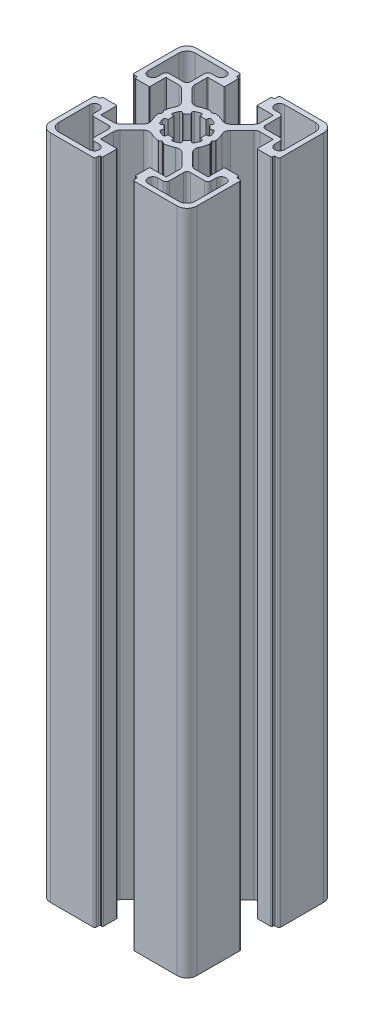
from build123d import *

# Parameters (mm, degrees)
BOSS_EXTRUDE1_DEPTH = 205


with BuildPart() as part:
    # Sketch1 → Boss-Extrude1 (new body)
    with BuildSketch(Plane(origin=(0, 0, 0), x_dir=(1, 0, 0), z_dir=(0, 1, 0))):
        with BuildLine():
            Line((7.563483841, 5.858695924), (11.129779796, 9.424987881))
            ThreePointArc((11.129779796, 9.424987881), (11.76062452, 9.846504465), (12.504756421, 9.994521395))
            Line((12.504756421, 9.994521395), (16.316902359, 9.994521395))
            ThreePointArc((16.316902359, 9.994521395), (16.458323963, 9.935942648), (16.51690271, 9.794521044))
            Line((16.51690271, 9.794521044), (16.51690271, 5.20001408))
            ThreePointArc((16.51690271, 5.20001408), (16.575481456, 5.058592476), (16.716903061, 5.000013729))
            Line((16.716903061, 5.000013729), (20.719599813, 5.000013729))
            ThreePointArc((20.719599813, 5.000013729), (20.931731335, 5.087881483), (21.019599089, 5.300013005))
            Line((21.019599089, 5.300013005), (21.019599089, 5.500003954))
            ThreePointArc((21.019599089, 5.500003954), (21.107466988, 5.71213583), (21.319598864, 5.800003729))
            Line((21.319598864, 5.800003729), (21.999979422, 5.800003729))
            ThreePointArc((21.999979422, 5.800003729), (22.353532548, 5.946450229), (22.499979048, 6.300003356))
            Line((22.499979048, 6.300003356), (22.499979048, 19.500015971))
            ThreePointArc((22.499979048, 19.500015971), (21.621300048, 21.62133473), (19.499981289, 22.50001373))
            Line((19.499981289, 22.50001373), (6.37570892, 22.50001373))
            ThreePointArc((6.37570892, 22.50001373), (6.022155794, 22.35356723), (5.875709294, 22.000014103))
            Line((5.875709294, 22.000014103), (5.875709294, 21.300013005))
            ThreePointArc((5.875709294, 21.300013005), (5.78784154, 21.087881482), (5.575710018, 21.000013729))
            Line((5.575710018, 21.000013729), (5.299998684, 21.000013729))
            ThreePointArc((5.299998684, 21.000013729), (5.087867516, 20.912146122), (4.999999909, 20.700014953))
            Line((4.999999909, 20.700014953), (4.999999909, 16.666812288))
            ThreePointArc((4.999999909, 16.666812288), (5.058578802, 16.52539033), (5.20000076, 16.466811437))
            Line((5.20000076, 16.466811437), (9.905385127, 16.466811437))
            ThreePointArc((9.905385127, 16.466811437), (10.046806731, 16.408232691), (10.105385478, 16.266811086))
            Line((10.105385478, 16.266811086), (10.105385478, 12.471582811))
            ThreePointArc((10.105385478, 12.471582811), (9.953144497, 11.706215717), (9.519598864, 11.057368824))
            Line((9.519598864, 11.057368824), (5.944897897, 7.482667857))
            ThreePointArc((5.944897897, 7.482667857), (4.854602604, 6.96783564), (3.666501718, 7.17329201))
            ThreePointArc((3.666501718, 7.17329201), (2.308631207, 7.714000899), (0.875344921, 8.000128222))
            ThreePointArc((0.875344921, 8.000128222), (0.813048151, 7.996979672), (0.754751151, 7.974792726))
            Line((0.754751151, 7.974792726), (0.112630526, 7.606936313))
            ThreePointArc((0.112630526, 7.606936313), (0.062965968, 7.559088119), (2.065e-06, 7.530953356))
            ThreePointArc((2.065e-06, 7.530953356), (-0.062961837, 7.559088119), (-0.112626394, 7.606936313))
            Line((-0.112626394, 7.606936313), (-0.754745572, 7.974791896))
            ThreePointArc((-0.754745572, 7.974791896), (-0.813042564, 7.99697884), (-0.875339325, 8.000127394))
            ThreePointArc((-0.875339325, 8.000127394), (-2.308625867, 7.714000103), (-3.666496612, 7.173291142))
            ThreePointArc((-3.666496612, 7.173291142), (-4.854599203, 6.967834938), (-5.944895348, 7.482669215))
            Line((-5.944895348, 7.482669215), (-9.519596331, 11.057370197))
            ThreePointArc((-9.519596331, 11.057370197), (-9.953141964, 11.70621709), (-10.105382945, 12.471584185))
            Line((-10.105382945, 12.471584185), (-10.105382945, 16.266811086))
            ThreePointArc((-10.105382945, 16.266811086), (-10.046804198, 16.408232691), (-9.905382594, 16.466811437))
            Line((-9.905382594, 16.466811437), (-5.200000942, 16.466811437))
            ThreePointArc((-5.200000942, 16.466811437), (-5.058578984, 16.52539033), (-5.000000091, 16.666812288))
            Line((-5.000000091, 16.666812288), (-5.000000091, 20.700014953))
            ThreePointArc((-5.000000091, 20.700014953), (-5.087867699, 20.912146122), (-5.299998867, 21.000013729))
            Line((-5.299998867, 21.000013729), (-5.575710202, 21.000013729))
            ThreePointArc((-5.575710202, 21.000013729), (-5.787841724, 21.087881482), (-5.875709478, 21.300013005))
            Line((-5.875709478, 21.300013005), (-5.875709478, 22.000014104))
            ThreePointArc((-5.875709478, 22.000014104), (-6.022155978, 22.35356723), (-6.375709104, 22.50001373))
            Line((-6.375709104, 22.50001373), (-19.499981473, 22.50001373))
            ThreePointArc((-19.499981473, 22.50001373), (-21.621300232, 21.62133473), (-22.499979232, 19.500015971))
            Line((-22.499979232, 19.500015971), (-22.499979232, 6.300003356))
            ThreePointArc((-22.499979232, 6.300003356), (-22.353532732, 5.946450229), (-21.999979605, 5.800003729))
            Line((-21.999979605, 5.800003729), (-21.319599047, 5.800003729))
            ThreePointArc((-21.319599047, 5.800003729), (-21.107467171, 5.71213583), (-21.019599271, 5.500003954))
            Line((-21.019599271, 5.500003954), (-21.019599271, 5.300013005))
            ThreePointArc((-21.019599271, 5.300013005), (-20.931731518, 5.087881483), (-20.719599995, 5.000013729))
            Line((-20.719599995, 5.000013729), (-16.716903244, 5.000013729))
            ThreePointArc((-16.716903244, 5.000013729), (-16.57548164, 5.058592476), (-16.516902894, 5.20001408))
            Line((-16.516902894, 5.20001408), (-16.516902894, 9.794521044))
            ThreePointArc((-16.516902894, 9.794521044), (-16.458324147, 9.935942648), (-16.316902543, 9.994521395))
            Line((-16.316902543, 9.994521395), (-12.504755574, 9.994521395))
            ThreePointArc((-12.504755574, 9.994521395), (-11.760623673, 9.846504465), (-11.129778949, 9.424987881))
            Line((-11.129778949, 9.424987881), (-7.563484024, 5.858696956))
            ThreePointArc((-7.563484024, 5.858696956), (-7.018857309, 4.793955357), (-7.200363541, 3.611860429))
            ThreePointArc((-7.200363541, 3.611860429), (-7.719534914, 2.299057702), (-7.999860794, 0.915436613))
            ThreePointArc((-7.999860794, 0.915436613), (-7.996805132, 0.851929863), (-7.97397167, 0.792591196))
            Line((-7.97397167, 0.792591196), (-7.540055962, 0.046829926))
            ThreePointArc((-7.540055962, 0.046829926), (-7.534291471, 0.023676009), (-7.531325428, 3.7e-07))
            ThreePointArc((-7.531325428, 3.7e-07), (-7.534291471, -0.023675268), (-7.540055962, -0.046829185))
            Line((-7.540055962, -0.046829185), (-7.97397167, -0.792590455))
            ThreePointArc((-7.97397167, -0.792590455), (-7.996805132, -0.851929122), (-7.999860794, -0.915435872))
            ThreePointArc((-7.999860794, -0.915435872), (-7.719534914, -2.299056961), (-7.200363541, -3.611859688))
            ThreePointArc((-7.200363541, -3.611859688), (-7.018857309, -4.793954616), (-7.563484024, -5.858696215))
            Line((-7.563484024, -5.858696215), (-11.12977998, -9.424988171))
            ThreePointArc((-11.12977998, -9.424988171), (-11.760624704, -9.846504756), (-12.504756605, -9.994521685))
            Line((-12.504756605, -9.994521685), (-16.316902543, -9.994521685))
            ThreePointArc((-16.316902543, -9.994521685), (-16.458324147, -9.935942938), (-16.516902894, -9.794521334))
            Line((-16.516902894, -9.794521334), (-16.516902894, -5.200014371))
            ThreePointArc((-16.516902894, -5.200014371), (-16.57548164, -5.058592767), (-16.716903244, -5.000014021))
            Line((-16.716903244, -5.000014021), (-20.719599995, -5.000014021))
            ThreePointArc((-20.719599995, -5.000014021), (-20.931731518, -5.087881774), (-21.019599271, -5.300013296))
            Line((-21.019599271, -5.300013296), (-21.019599271, -5.500004245))
            ThreePointArc((-21.019599271, -5.500004245), (-21.107467171, -5.71213612), (-21.319599047, -5.80000402))
            Line((-21.319599047, -5.80000402), (-21.999979605, -5.80000402))
            ThreePointArc((-21.999979605, -5.80000402), (-22.353532732, -5.94645052), (-22.499979232, -6.300003647))
            Line((-22.499979232, -6.300003647), (-22.499979232, -19.500016261))
            ThreePointArc((-22.499979232, -19.500016261), (-21.621300232, -21.62133502), (-19.499981473, -22.50001402))
            Line((-19.499981473, -22.50001402), (-6.375709104, -22.50001402))
            ThreePointArc((-6.375709104, -22.50001402), (-6.022155978, -22.35356752), (-5.875709478, -22.000014394))
            Line((-5.875709478, -22.000014394), (-5.875709478, -21.300013295))
            ThreePointArc((-5.875709478, -21.300013295), (-5.787841724, -21.087881773), (-5.575710202, -21.000014019))
            Line((-5.575710202, -21.000014019), (-5.299998867, -21.000014019))
            ThreePointArc((-5.299998867, -21.000014019), (-5.087867699, -20.912146412), (-5.000000091, -20.700015244))
            Line((-5.000000091, -20.700015244), (-5.000000091, -16.666812578))
            ThreePointArc((-5.000000091, -16.666812578), (-5.058578984, -16.52539062), (-5.200000942, -16.466811727))
            Line((-5.200000942, -16.466811727), (-9.905382594, -16.466811727))
            ThreePointArc((-9.905382594, -16.466811727), (-10.046804198, -16.40823298), (-10.105382945, -16.266811376))
            Line((-10.105382945, -16.266811376), (-10.105382945, -12.471581681))
            ThreePointArc((-10.105382945, -12.471581681), (-9.953141964, -11.706214586), (-9.519596331, -11.057367693))
            Line((-9.519596331, -11.057367693), (-5.944895364, -7.482666726))
            ThreePointArc((-5.944895364, -7.482666726), (-4.854601518, -6.967832762), (-3.66650075, -7.173286521))
            ThreePointArc((-3.66650075, -7.173286521), (-2.30862839, -7.713996836), (-0.875339942, -8.000124808))
            ThreePointArc((-0.875339942, -8.000124808), (-0.81304361, -7.99697628), (-0.754747019, -7.97478949))
            Line((-0.754747019, -7.97478949), (-0.112626395, -7.606933078))
            ThreePointArc((-0.112626395, -7.606933078), (-0.062961838, -7.559084884), (2.065e-06, -7.530950121))
            ThreePointArc((2.065e-06, -7.530950121), (0.062965968, -7.559084884), (0.112630526, -7.606933078))
            Line((0.112630526, -7.606933078), (0.754751151, -7.974789491))
            ThreePointArc((0.754751151, -7.974789491), (0.813048151, -7.996976437), (0.875344921, -8.000124987))
            ThreePointArc((0.875344921, -8.000124987), (2.308629801, -7.71399808), (3.666499103, -7.173290103))
            ThreePointArc((3.666499103, -7.173290103), (4.854601719, -6.967833865), (5.944897897, -7.482668146))
            Line((5.944897897, -7.482668146), (9.519598864, -11.057369113))
            ThreePointArc((9.519598864, -11.057369113), (9.953144497, -11.706216006), (10.105385478, -12.471583101))
            Line((10.105385478, -12.471583101), (10.105385478, -16.266811376))
            ThreePointArc((10.105385478, -16.266811376), (10.046806731, -16.40823298), (9.905385127, -16.466811727))
            Line((9.905385127, -16.466811727), (5.20000076, -16.466811727))
            ThreePointArc((5.20000076, -16.466811727), (5.058578802, -16.52539062), (4.999999909, -16.666812578))
            Line((4.999999909, -16.666812578), (4.999999909, -20.700015244))
            ThreePointArc((4.999999909, -20.700015244), (5.087867516, -20.912146412), (5.299998684, -21.000014019))
            Line((5.299998684, -21.000014019), (5.575710018, -21.000014019))
            ThreePointArc((5.575710018, -21.000014019), (5.78784154, -21.087881773), (5.875709294, -21.300013295))
            Line((5.875709294, -21.300013295), (5.875709294, -22.000014394))
            ThreePointArc((5.875709294, -22.000014394), (6.022155794, -22.35356752), (6.37570892, -22.50001402))
            Line((6.37570892, -22.50001402), (19.499981289, -22.50001402))
            ThreePointArc((19.499981289, -22.50001402), (21.621300048, -21.62133502), (22.499979048, -19.500016261))
            Line((22.499979048, -19.500016261), (22.499979048, -6.300003646))
            ThreePointArc((22.499979048, -6.300003646), (22.353532548, -5.94645052), (21.999979422, -5.80000402))
            Line((21.999979422, -5.80000402), (21.319598864, -5.80000402))
            ThreePointArc((21.319598864, -5.80000402), (21.107466988, -5.71213612), (21.019599089, -5.500004245))
            Line((21.019599089, -5.500004245), (21.019599089, -5.300013297))
            ThreePointArc((21.019599089, -5.300013297), (20.931731335, -5.087881774), (20.719599813, -5.000014021))
            Line((20.719599813, -5.000014021), (16.716903061, -5.000014021))
            ThreePointArc((16.716903061, -5.000014021), (16.575481456, -5.058592767), (16.51690271, -5.200014371))
            Line((16.51690271, -5.200014371), (16.51690271, -9.794521334))
            ThreePointArc((16.51690271, -9.794521334), (16.458323963, -9.935942938), (16.316902359, -9.994521685))
            Line((16.316902359, -9.994521685), (12.504756421, -9.994521685))
            ThreePointArc((12.504756421, -9.994521685), (11.76062452, -9.846504756), (11.129779797, -9.424988171))
            Line((11.129779797, -9.424988171), (7.56348384, -5.858696215))
            ThreePointArc((7.56348384, -5.858696215), (7.018857125, -4.793954616), (7.200363357, -3.611859689))
            ThreePointArc((7.200363357, -3.611859689), (7.71953473, -2.299056961), (7.99986061, -0.915435872))
            ThreePointArc((7.99986061, -0.915435872), (7.996804948, -0.851929122), (7.973971486, -0.792590456))
            Line((7.973971486, -0.792590456), (7.54005578, -0.046829188))
            ThreePointArc((7.54005578, -0.046829188), (7.53429135, -0.023675779), (7.531325245, -6.6e-07))
            ThreePointArc((7.531325245, -6.6e-07), (7.534291289, 0.023674979), (7.54005578, 0.046828898))
            Line((7.54005578, 0.046828898), (7.973971486, 0.792590166))
            ThreePointArc((7.973971486, 0.792590166), (7.996804949, 0.851928832), (7.99986061, 0.915435582))
            ThreePointArc((7.99986061, 0.915435582), (7.719534731, 2.299056671), (7.200363358, 3.611859399))
            ThreePointArc((7.200363358, 3.611859399), (7.018857126, 4.793954326), (7.563483841, 5.858695924))
        make_face()
        with BuildLine():
            Line((-17.99997923, 9.000204729), (-17.99997923, 10.550013476))
            ThreePointArc((-17.99997923, 10.550013476), (-17.70708623, 11.257119729), (-16.999979977, 11.550012729))
            Line((-16.999979977, 11.550012729), (-12.549977483, 11.550012729))
            ThreePointArc((-12.549977483, 11.550012729), (-11.84287123, 11.842905729), (-11.54997823, 12.550011982))
            Line((-11.54997823, 12.550011982), (-11.54997823, 17.000014476))
            ThreePointArc((-11.54997823, 17.000014476), (-11.25708523, 17.707120729), (-10.549978977, 18.000013729))
            Line((-10.549978977, 18.000013729), (-8.99997923, 18.000013729))
            ThreePointArc((-8.99997923, 18.000013729), (-7.49997923, 19.500013729), (-8.99997923, 21.000013729))
            Line((-8.99997923, 21.000013729), (-18.499981098, 21.000013729))
            ThreePointArc((-18.499981098, 21.000013729), (-20.26774673, 20.267781229), (-20.99997923, 18.500015597))
            Line((-20.99997923, 18.500015597), (-20.99997923, 9.000204729))
            ThreePointArc((-20.99997923, 9.000204729), (-19.49997923, 7.500204729), (-17.99997923, 9.000204729))
        make_face(mode=Mode.SUBTRACT)
        with BuildLine():
            Line((0.967518273, 5.481094418), (0.867385333, 4.924170439))
            ThreePointArc((0.867385333, 4.924170439), (-3.404e-06, 4.999981493), (-0.867392141, 4.924170439))
            Line((-0.867392141, 4.924170439), (-0.967525085, 5.48109443))
            ThreePointArc((-0.967525085, 5.48109443), (-1.18787304, 5.829596016), (-1.595121059, 5.894060173))
            ThreePointArc((-1.595121059, 5.894060173), (-2.337474987, 5.644060679), (-3.0416713, 5.300991221))
            ThreePointArc((-3.0416713, 5.300991221), (-3.284300912, 4.965857552), (-3.191387249, 4.562681715))
            Line((-3.191387249, 4.562681715), (-2.864003826, 4.098457013))
            ThreePointArc((-2.864003826, 4.098457013), (-3.530136355, 3.540908116), (-4.089716295, 2.876480837))
            Line((-4.089716295, 2.876480837), (-4.566781049, 3.208143991))
            ThreePointArc((-4.566781049, 3.208143991), (-4.968981864, 3.298752353), (-5.302521511, 3.056416481))
            ThreePointArc((-5.302521511, 3.056416481), (-5.650679971, 2.354692469), (-5.906040083, 1.614137194))
            ThreePointArc((-5.906040083, 1.614137194), (-5.840630787, 1.205603075), (-5.48985103, 0.986212864))
            Line((-5.48985103, 0.986212864), (-4.920549171, 0.887804317))
            ThreePointArc((-4.920549171, 0.887804317), (-5.000003405, -1.8509e-05), (-4.92054917, -0.887841334))
            Line((-4.92054917, -0.887841334), (-5.48973413, -0.986229672))
            ThreePointArc((-5.48973413, -0.986229672), (-5.84059179, -1.205595835), (-5.906027737, -1.614179668))
            ThreePointArc((-5.906027737, -1.614179668), (-5.650660878, -2.354735576), (-5.302495324, -3.056459191))
            ThreePointArc((-5.302495324, -3.056459191), (-4.968965627, -3.298777294), (-4.566781049, -3.208181006))
            Line((-4.566781049, -3.208181006), (-4.089716295, -2.876517852))
            ThreePointArc((-4.089716295, -2.876517852), (-3.530136355, -3.540945131), (-2.864003826, -4.098494028))
            Line((-2.864003826, -4.098494028), (-3.191315305, -4.562616715))
            ThreePointArc((-3.191315305, -4.562616715), (-3.284288314, -4.9658247), (-3.041645074, -5.301003633))
            ThreePointArc((-3.041645074, -5.301003633), (-2.337436005, -5.644074141), (-1.595068803, -5.894071587))
            ThreePointArc((-1.595068803, -5.894071587), (-1.187863583, -5.829591875), (-0.967525085, -5.481131446))
            Line((-0.967525085, -5.481131446), (-0.867392142, -4.924207454))
            ThreePointArc((-0.867392142, -4.924207454), (-3.405e-06, -5.000018508), (0.867385333, -4.924207454))
            Line((0.867385333, -4.924207454), (0.967518273, -5.481131433))
            ThreePointArc((0.967518273, -5.481131433), (1.187884068, -5.829612183), (1.595127065, -5.894056407))
            ThreePointArc((1.595127065, -5.894056407), (2.337463214, -5.64406402), (3.04164388, -5.301006091))
            ThreePointArc((3.04164388, -5.301006091), (3.284272431, -4.965888777), (3.191382531, -4.562721697))
            Line((3.191382531, -4.562721697), (2.863997017, -4.098494027))
            ThreePointArc((2.863997017, -4.098494027), (3.530129546, -3.540945131), (4.089709486, -2.876517851))
            Line((4.089709486, -2.876517851), (4.56677425, -3.208181013))
            ThreePointArc((4.56677425, -3.208181013), (4.968991235, -3.298778206), (5.302526078, -3.056413061))
            ThreePointArc((5.302526078, -3.056413061), (5.650679647, -2.354700627), (5.90603791, -1.614157983))
            ThreePointArc((5.90603791, -1.614157983), (5.840629826, -1.205623017), (5.489849863, -0.98623192))
            Line((5.489849863, -0.98623192), (4.920545674, -0.88782297))
            ThreePointArc((4.920545674, -0.88782297), (4.999996595, -1.94e-07), (4.92053917, 0.887822))
            Line((4.92053917, 0.887822), (5.489724104, 0.986210336))
            ThreePointArc((5.489724104, 0.986210336), (5.840595493, 1.20557008), (5.90603791, 1.614161218))
            ThreePointArc((5.90603791, 1.614161218), (5.650669489, 2.354728137), (5.302499707, 3.056461843))
            ThreePointArc((5.302499707, 3.056461843), (4.968955649, 3.298763634), (4.56677425, 3.208143998))
            Line((4.56677425, 3.208143998), (4.089709486, 2.876480836))
            ThreePointArc((4.089709486, 2.876480836), (3.530129546, 3.540908115), (2.863997017, 4.098457012))
            Line((2.863997017, 4.098457012), (3.191308496, 4.562579701))
            ThreePointArc((3.191308496, 4.562579701), (3.284310107, 4.965799272), (3.041663899, 5.300997928))
            ThreePointArc((3.041663899, 5.300997928), (2.337448292, 5.644073372), (1.595073641, 5.894073887))
            ThreePointArc((1.595073641, 5.894073887), (1.18784779, 5.829586125), (0.967518273, 5.481094418))
        make_face(mode=Mode.SUBTRACT)
        with BuildLine():
            Line((-20.99997923, -9.000205019), (-20.99997923, -18.500015887))
            ThreePointArc((-20.99997923, -18.500015887), (-20.26774673, -20.267781519), (-18.499981098, -21.000014019))
            Line((-18.499981098, -21.000014019), (-8.99997923, -21.000014019))
            ThreePointArc((-8.99997923, -21.000014019), (-7.49997923, -19.500014019), (-8.99997923, -18.000014019))
            Line((-8.99997923, -18.000014019), (-10.549978977, -18.000014019))
            ThreePointArc((-10.549978977, -18.000014019), (-11.25708523, -17.707121019), (-11.54997823, -17.000014766))
            Line((-11.54997823, -17.000014766), (-11.54997823, -12.550012272))
            ThreePointArc((-11.54997823, -12.550012272), (-11.84287123, -11.842906019), (-12.549977483, -11.550013019))
            Line((-12.549977483, -11.550013019), (-16.999979977, -11.550013019))
            ThreePointArc((-16.999979977, -11.550013019), (-17.70708623, -11.257120019), (-17.99997923, -10.550013766))
            Line((-17.99997923, -10.550013766), (-17.99997923, -9.000205019))
            ThreePointArc((-17.99997923, -9.000205019), (-19.49997923, -7.500205019), (-20.99997923, -9.000205019))
        make_face(mode=Mode.SUBTRACT)
        with BuildLine():
            Line((20.999979046, 9.000204729), (20.999979046, 18.500015597))
            ThreePointArc((20.999979046, 18.500015597), (20.267746546, 20.267781229), (18.499980914, 21.000013729))
            Line((18.499980914, 21.000013729), (8.999979046, 21.000013729))
            ThreePointArc((8.999979046, 21.000013729), (7.499979046, 19.500013729), (8.999979046, 18.000013729))
            Line((8.999979046, 18.000013729), (10.549978793, 18.000013729))
            ThreePointArc((10.549978793, 18.000013729), (11.257085046, 17.707120729), (11.549978046, 17.000014476))
            Line((11.549978046, 17.000014476), (11.549978046, 12.550011982))
            ThreePointArc((11.549978046, 12.550011982), (11.842871046, 11.842905729), (12.549977299, 11.550012729))
            Line((12.549977299, 11.550012729), (16.999979793, 11.550012729))
            ThreePointArc((16.999979793, 11.550012729), (17.707086046, 11.257119729), (17.999979046, 10.550013476))
            Line((17.999979046, 10.550013476), (17.999979046, 9.000204729))
            ThreePointArc((17.999979046, 9.000204729), (19.499979046, 7.500204729), (20.999979046, 9.000204729))
        make_face(mode=Mode.SUBTRACT)
        with BuildLine():
            Line((16.999979793, -11.550013019), (12.549977299, -11.550013019))
            ThreePointArc((12.549977299, -11.550013019), (11.842871046, -11.842906019), (11.549978046, -12.550012272))
            Line((11.549978046, -12.550012272), (11.549978046, -17.000014766))
            ThreePointArc((11.549978046, -17.000014766), (11.257085046, -17.707121019), (10.549978793, -18.000014019))
            Line((10.549978793, -18.000014019), (8.999979046, -18.000014019))
            ThreePointArc((8.999979046, -18.000014019), (7.499979046, -19.500014019), (8.999979046, -21.000014019))
            Line((8.999979046, -21.000014019), (18.499980914, -21.000014019))
            ThreePointArc((18.499980914, -21.000014019), (20.267746546, -20.267781519), (20.999979046, -18.500015887))
            Line((20.999979046, -18.500015887), (20.999979046, -9.000205019))
            ThreePointArc((20.999979046, -9.000205019), (19.499979046, -7.500205019), (17.999979046, -9.000205019))
            Line((17.999979046, -9.000205019), (17.999979046, -10.550013766))
            ThreePointArc((17.999979046, -10.550013766), (17.707086046, -11.257120019), (16.999979793, -11.550013019))
        make_face(mode=Mode.SUBTRACT)
    extrude(amount=BOSS_EXTRUDE1_DEPTH)


solid = part.part
